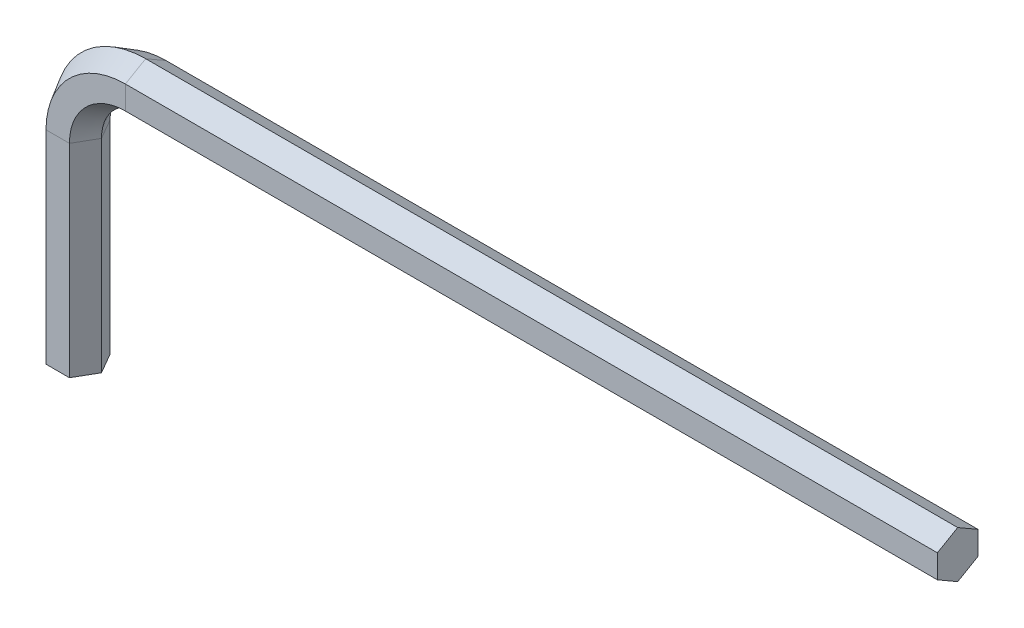
from build123d import *


with BuildPart() as part:
    # Sweep1: sweep along a path in Sketch1
    with BuildLine(Plane.XY) as sweep1_path:
        Line((0, 0), (0, 15))
        ThreePointArc((0, 15), (1.464466094, 18.535533906), (5, 20))
        Line((5, 20), (65, 20))
    # Sketch2 → Sweep1 (sweep)
    with BuildSketch(Plane(origin=(0, 0, 0), x_dir=(1, 0, 0), z_dir=(0, 1, 0))):
        Polygon((0.866025404, -1.5), (1.732050808, 0), (0.866025404, 1.5), (-0.866025404, 1.5), (-1.732050808, 0), (-0.866025404, -1.5), align=None)
    sweep(path=sweep1_path.line)


solid = part.part
